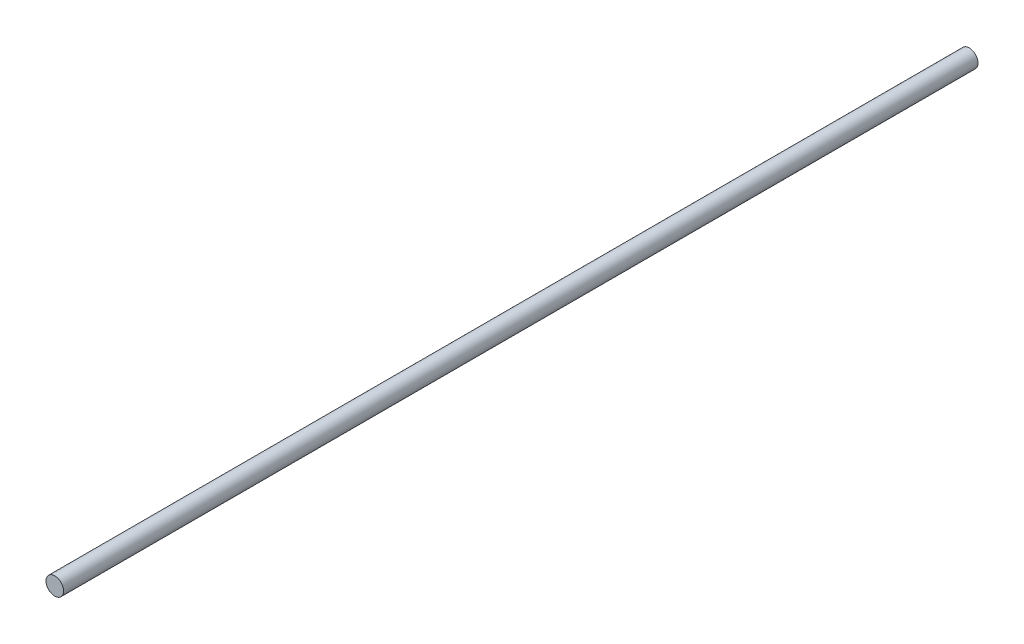
from build123d import *

# Parameters (mm, degrees)
SKETCH1_R           = 1
BOSS_EXTRUDE1_DEPTH = 104


with BuildPart() as part:
    # Sketch1 → Boss-Extrude1 (new body)
    with BuildSketch(Plane.XY):
        with Locations(Location((0, 0, 0), (0, 0, 180))):
            Circle(SKETCH1_R)
    extrude(amount=BOSS_EXTRUDE1_DEPTH)


solid = part.part
